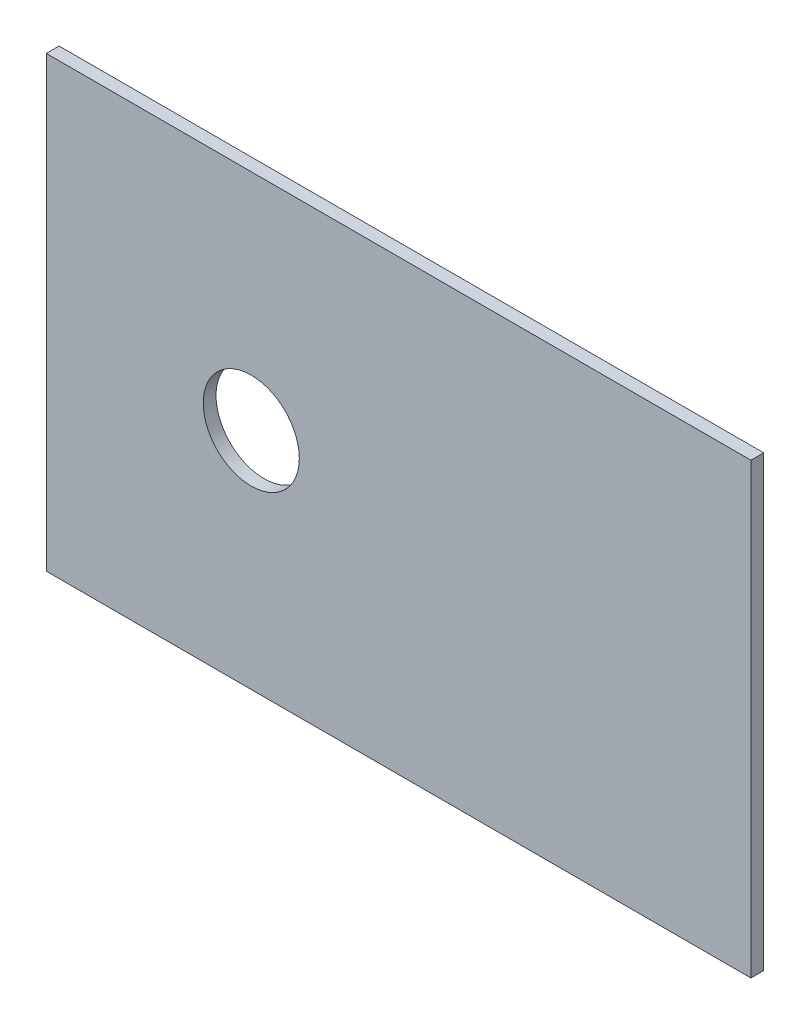
from build123d import *

# Parameters (mm, degrees)
SKETCH1_W           = 139.7
SKETCH1_H           = 88.9
BOSS_EXTRUDE1_DEPTH = 2.54
SKETCH2_R           = 9.525
CUT_EXTRUDE1_DEPTH  = 2.54


with BuildPart() as part:
    # Sketch1 → Boss-Extrude1 (new body)
    with BuildSketch(Plane.XY):
        with Locations((9.453383459, -18.584492481)):
            Rectangle(SKETCH1_W, SKETCH1_H)
    extrude(amount=BOSS_EXTRUDE1_DEPTH)

    # Sketch2 → Cut-Extrude1 (cut)
    with BuildSketch(Plane.XY.offset(2.54)):
        with Locations((-19.756616541, -18.584492481)):
            Circle(SKETCH2_R)
    extrude(amount=-CUT_EXTRUDE1_DEPTH, mode=Mode.SUBTRACT)


solid = part.part
